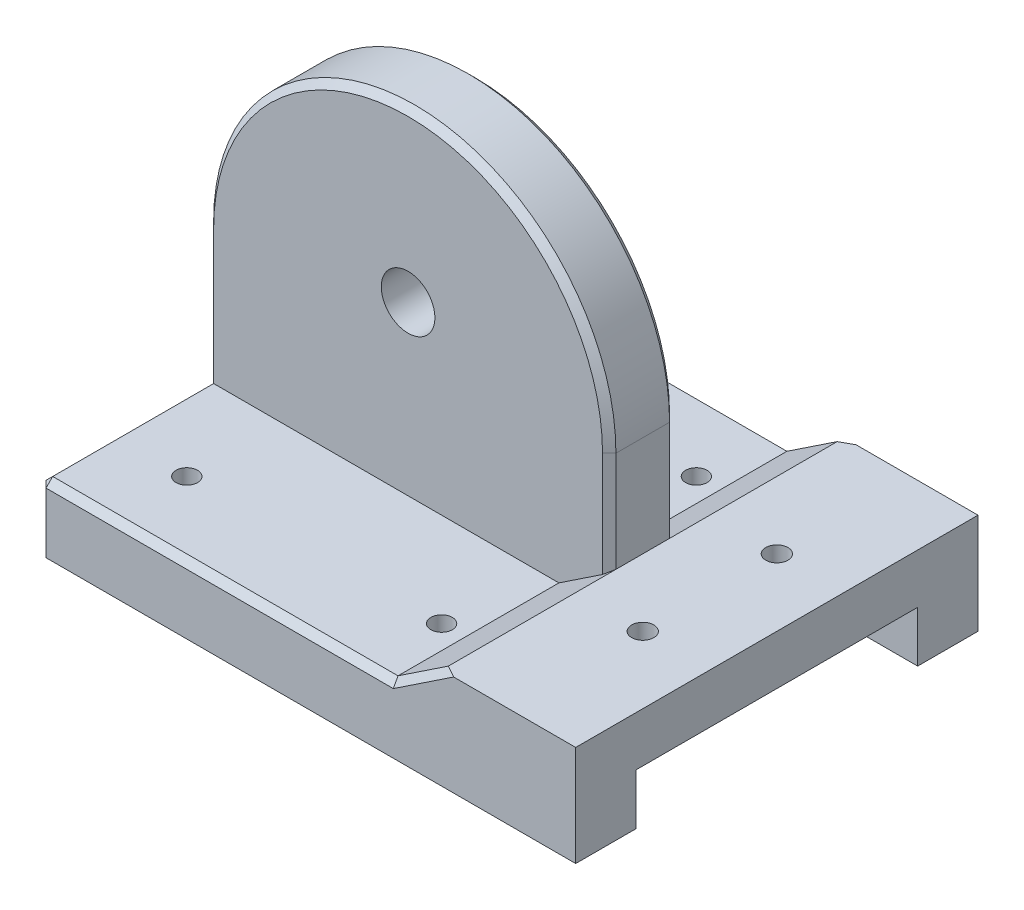
from build123d import *

# Parameters (mm, degrees)
SKETCH_1_W                = 60
SKETCH_1_H                = 50
EXTRUDE_1_DEPTH           = 10
SKETCH_8_W                = 80
SKETCH_8_H                = 60
EXTRUDE_2_DEPTH           = 10
SKETCH_11_W               = 20
SKETCH_11_H               = 7.6
CUT_EXTRUDE_1_DEPTH       = 21
SKETCH_12_W               = 20
SKETCH_12_H               = 5
EXTRUDE_4_DEPTH           = 30
HOLE_WIZARD_4_D           = 3.3
EXTRUDE_START             = -60
EXTRUDE_5_DEPTH           = 60
FILLET_1_RADIUS           = 30
FILLET_1_LENGTH           = 10
CHAMFER_1_SIZE            = 1
HOLE_WIZARD_5_D           = 8
HOLE_WIZARD_5_CSINK_D     = 8.5
HOLE_WIZARD_5_CSINK_ANGLE = 45
SKETCH_18_R               = 4.75
SKETCH_18_R_2             = 4.25
EXTRUDE_6_DEPTH           = 10
HOLE_WIZARD_6_D           = 3.2


with BuildPart() as part:
    # 草图1 → 凸台-拉伸1 (new body)
    with BuildSketch(Plane.XY):
        Rectangle(SKETCH_1_W, SKETCH_1_H)
    extrude(amount=EXTRUDE_1_DEPTH)

    # 草图8 → 凸台-拉伸2 (add)
    with BuildSketch(Plane.XZ.offset(25)):
        with Locations((10, 5)):
            Rectangle(SKETCH_8_W, SKETCH_8_H)
    extrude(amount=EXTRUDE_2_DEPTH)

    # 草图11 → 切除-拉伸1 (cut, symmetric)
    with BuildSketch(Plane.XY.offset(5)):
        with Locations((40, -31.2)):
            Rectangle(SKETCH_11_W, SKETCH_11_H)
    extrude(amount=CUT_EXTRUDE_1_DEPTH, both=True, mode=Mode.SUBTRACT)

    # 草图12 → 凸台-拉伸4 (add, symmetric)
    with BuildSketch(Plane.XY.offset(5)):
        with Locations((40, -22.5)):
            Rectangle(SKETCH_12_W, SKETCH_12_H)
    extrude(amount=EXTRUDE_4_DEPTH, both=True)

    # 孔4 (through all)
    with Locations(Plane(origin=(0, -20, 0), x_dir=(1, 0, 0), z_dir=(0, 1, 0))):
        with Locations((40, -15), (40, 5)):
            Hole(HOLE_WIZARD_4_D / 2)

    # 草图15 → 凸台-拉伸5 (add)
    with BuildSketch(Plane.XY.offset(35).offset(EXTRUDE_START)):
        Polygon((30, -20), (22.5, -25), (30, -25), align=None)
    extrude(amount=EXTRUDE_5_DEPTH)

    # 圆角1: full round fillet: the end face becomes a half cylinder, R = half its width
    fillet_1_face = Plane((0, 25, 5), x_dir=(0, 0, 1), z_dir=(0, 1, 0))  # on the end face: x along it, z out of the body
    fillet_1_slab = fillet_1_face.offset(-FILLET_1_RADIUS / 2) * Box(FILLET_1_LENGTH, 2 * FILLET_1_RADIUS, FILLET_1_RADIUS, mode=Mode.PRIVATE)  # the body's end, R deep
    fillet_1_round = Plane((0, -5, 5), x_dir=(0, 1, 0), z_dir=(0, 0, 1)) * Cylinder(FILLET_1_RADIUS, FILLET_1_LENGTH, mode=Mode.PRIVATE)  # its axis R under the face
    add(fillet_1_slab - fillet_1_round, mode=Mode.SUBTRACT)

    # 倒角1
    chamfer_1_edges = [part.edges().sort_by_distance(p)[0] for p in [
        (-30, -25, 22.5),
        (-30, -25, -12.5),
        (-30, -30, 35),
        (-3.75, -25, -25),
        (-30, -30, -25),
        (30, -12.5, 0),
        (30, -12.5, 10),
        (-3.75, -25, 35),
        (26.25, -22.5, -25),
        (26.25, -22.5, 35),
        (-30, -15, 0),
        (-30, -15, 10),
        (0, 25, 10),
        (0, 25, 0),
    ]]
    chamfer(chamfer_1_edges, length=CHAMFER_1_SIZE)

    # 孔5 (through all)
    with Locations(Plane(origin=(0, 0, 0), x_dir=(-1, 0, 0), z_dir=(0, 0, -1))):
        with Locations((0, 0)):
            CounterSinkHole(HOLE_WIZARD_5_D / 2, HOLE_WIZARD_5_CSINK_D / 2, counter_sink_angle=HOLE_WIZARD_5_CSINK_ANGLE)

    # 草图18 → 凸台-拉伸6 (add)
    with BuildSketch(Plane(origin=(0, 0, 0), x_dir=(-1, 0, 0), z_dir=(0, 0, -1))):
        Circle(SKETCH_18_R)
        Circle(SKETCH_18_R_2, mode=Mode.SUBTRACT)
    extrude(amount=EXTRUDE_6_DEPTH)

    # 孔6 (through all)
    with Locations(Plane(origin=(0, -25, 0), x_dir=(1, 0, 0), z_dir=(0, 1, 0))):
        with Locations((-19, 14), (19, 14), (19, -24), (-19, -24)):
            Hole(HOLE_WIZARD_6_D / 2)


solid = part.part
